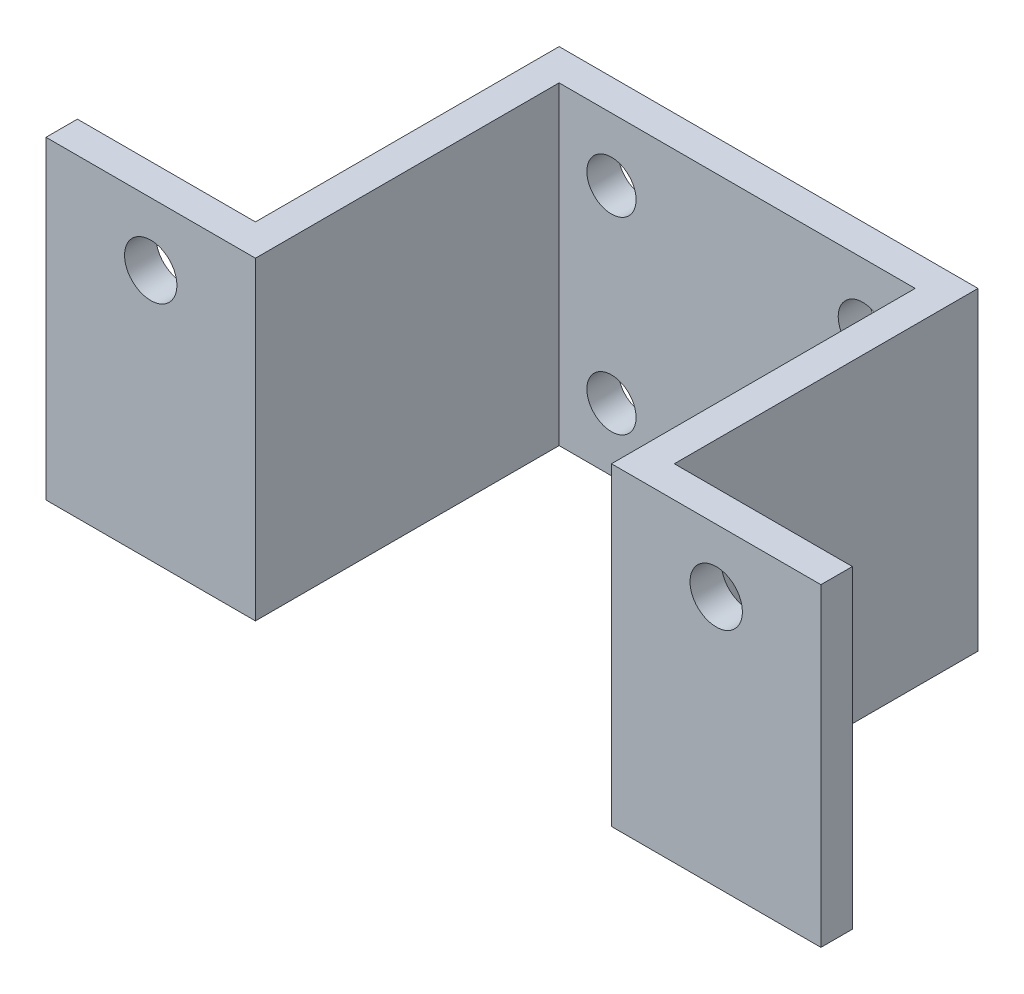
from build123d import *

# Parameters (mm, degrees)
SKETCH1_W           = 3
SKETCH1_H           = 3
SKETCH1_W_2         = 17
BOSS_EXTRUDE1_DEPTH = 30
SKETCH2_R           = 2.5
CUT_EXTRUDE1_DEPTH  = 30
SKETCH3_R           = 2.35
CUT_EXTRUDE2_DEPTH  = 30


with BuildPart() as part:
    # Sketch1 → Boss-Extrude1 (new body)
    with BuildSketch(Plane(origin=(0, 0, 0), x_dir=(1, 0, 0), z_dir=(0, 1, 0))):
        Polygon((-17, 29), (0, 29), (17, 29), (17, 3), (20, 3), (20, 32), (-20, 32), (-20, 3), (-17, 3), align=None)
        with Locations((-18.5, 1.5)):
            Rectangle(SKETCH1_W, SKETCH1_H)
        with Locations((-28.5, 1.5)):
            Rectangle(SKETCH1_W_2, SKETCH1_H)
        with Locations((18.5, 1.5)):
            Rectangle(SKETCH1_W, SKETCH1_H)
        with Locations((28.5, 1.5)):
            Rectangle(SKETCH1_W_2, SKETCH1_H)
    extrude(amount=BOSS_EXTRUDE1_DEPTH)

    # Sketch2 → Cut-Extrude1 (cut)
    with BuildSketch(Plane.XY):
        with Locations((-27, 24)):
            Circle(SKETCH2_R)
        with Locations((27, 24)):
            Circle(SKETCH2_R)
    extrude(amount=-CUT_EXTRUDE1_DEPTH, mode=Mode.SUBTRACT)

    # Sketch3 → Cut-Extrude2 (cut)
    with BuildSketch(Plane(origin=(0, 0, -32), x_dir=(-1, 0, 0), z_dir=(0, 0, -1))):
        with Locations((-12, 6)):
            Circle(SKETCH3_R)
        with Locations((12, 6)):
            Circle(SKETCH3_R)
        with Locations((12, 24)):
            Circle(SKETCH3_R)
        with Locations((-12, 24)):
            Circle(SKETCH3_R)
    extrude(amount=-CUT_EXTRUDE2_DEPTH, mode=Mode.SUBTRACT)


solid = part.part
